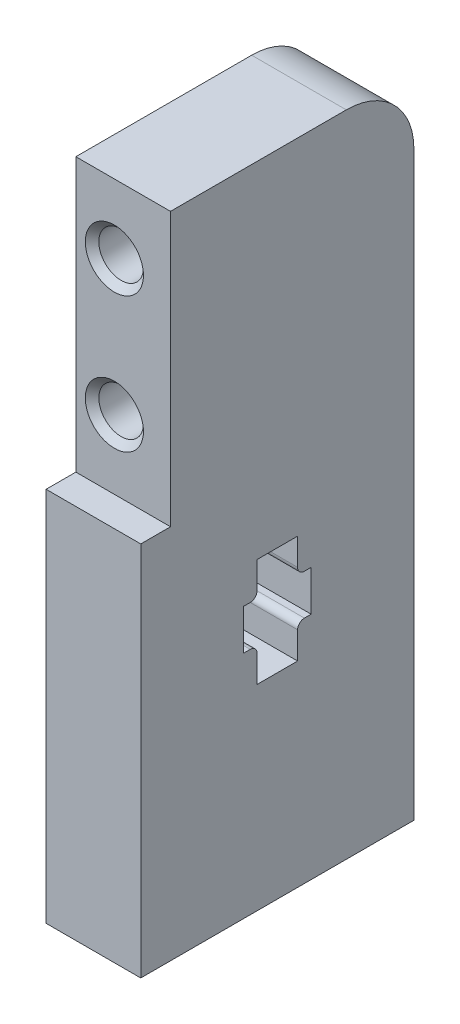
from build123d import *

# Parameters (mm, degrees)
CROQUIS1_W              = 20.2
CROQUIS1_H              = 48
SALIENTE_EXTRUIR1_DEPTH = 7
CROQUIS2_W              = 7
CROQUIS2_H              = 20.2
CORTAR_EXTRUIR1_DEPTH   = 2.2
CROQUIS3_R              = 1.65
CROQUIS3_R_2            = 1.62
CORTAR_EXTRUIR2_DEPTH   = 15
CROQUIS4_R              = 1.65
CORTAR_EXTRUIR3_DEPTH   = 15
CHAFL_N1_SIZE           = 0.5
REDONDEO1_R             = 5
CROQUIS5_W              = 5
CROQUIS5_H              = 3
CORTAR_EXTRUIR4_DEPTH   = 7
CROQUIS6_W              = 3
CROQUIS6_H              = 2.5
CORTAR_EXTRUIR5_DEPTH   = 7
REDONDEO2_R             = 0.5


with BuildPart() as part:
    # Croquis1 → Saliente-Extruir1 (new body)
    with BuildSketch(Plane(origin=(0, 0, 0), x_dir=(0, 0, -1), z_dir=(1, 0, 0))):
        with Locations((10.1, 24)):
            Rectangle(CROQUIS1_W, CROQUIS1_H)
    extrude(amount=SALIENTE_EXTRUIR1_DEPTH)

    # Croquis2 → Cortar-Extruir1 (cut)
    with BuildSketch(Plane.XY):
        with Locations((3.5, 37.9)):
            Rectangle(CROQUIS2_W, CROQUIS2_H)
    extrude(amount=-CORTAR_EXTRUIR1_DEPTH, mode=Mode.SUBTRACT)

    # Croquis3 → Cortar-Extruir2 (cut)
    with BuildSketch(Plane.XZ):
        with Locations(Location((2.85, -15.1, 0), (0, 0, 270))):
            Circle(CROQUIS3_R)
        with Locations(Location((2.85, -5.1, 0), (0, 0, 270))):
            Circle(CROQUIS3_R_2)
    extrude(amount=-CORTAR_EXTRUIR2_DEPTH, mode=Mode.SUBTRACT)

    # Croquis4 → Cortar-Extruir3 (cut)
    with BuildSketch(Plane.XY.offset(-2.2)):
        with Locations((2.85, 32.9)):
            Circle(CROQUIS4_R)
        with Locations((2.85, 42.9)):
            Circle(CROQUIS4_R)
    extrude(amount=-CORTAR_EXTRUIR3_DEPTH, mode=Mode.SUBTRACT)

    # Chaflán1
    chafl_n1_edges = [part.edges().sort_by_distance(p)[0] for p in [
        (2.85, 0, -3.48),
        (2.85, 0, -13.45),
        (1.2, 42.9, -2.2),
        (1.2, 32.9, -2.2),
    ]]
    chamfer(chafl_n1_edges, length=CHAFL_N1_SIZE)

    # Redondeo1
    redondeo1_edges = [part.edges().sort_by_distance(p)[0] for p in [
        (3.5, 48, -20.2),
    ]]
    fillet(redondeo1_edges, radius=REDONDEO1_R)

    # Croquis5 → Cortar-Extruir4 (cut)
    with BuildSketch(Plane(origin=(7, 0, 0), x_dir=(0, 0, -1), z_dir=(1, 0, 0))):
        with Locations((10.1, 18.5)):
            Rectangle(CROQUIS5_W, CROQUIS5_H)
    extrude(amount=-CORTAR_EXTRUIR4_DEPTH, mode=Mode.SUBTRACT)

    # Croquis6 → Cortar-Extruir5 (cut)
    with BuildSketch(Plane(origin=(7, 0, 0), x_dir=(0, 0, -1), z_dir=(1, 0, 0))):
        with Locations((10.1, 21.25)):
            Rectangle(CROQUIS6_W, CROQUIS6_H)
        with Locations((10.1, 15.75)):
            Rectangle(CROQUIS6_W, CROQUIS6_H)
    extrude(amount=-CORTAR_EXTRUIR5_DEPTH, mode=Mode.SUBTRACT)

    # Redondeo2
    redondeo2_edges = [part.edges().sort_by_distance(p)[0] for p in [
        (3.5, 20, -8.6),
        (3.5, 20, -11.6),
        (3.5, 17, -8.6),
        (3.5, 17, -11.6),
    ]]
    fillet(redondeo2_edges, radius=REDONDEO2_R)


solid = part.part
